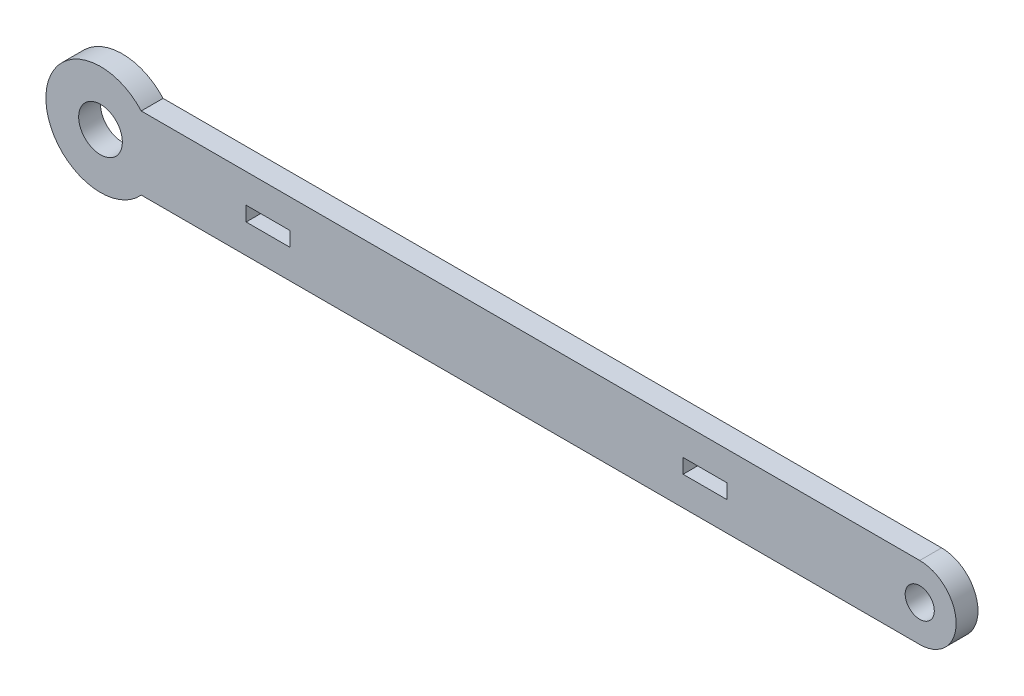
from build123d import *

# Parameters (mm, degrees)
SKETCH_1_R      = 2
SKETCH_1_R_2    = 3
SKETCH_1_W      = 6
SKETCH_1_H      = 2
EXTRUDE_1_DEPTH = 1.5


with BuildPart() as part:
    # 草图1 → 凸台-拉伸1 (new, symmetric)
    with BuildSketch(Plane.XY):
        with BuildLine():
            Line((5.590169944, 5), (112.5, 5))
            ThreePointArc((112.5, 5), (117.5, 0), (112.5, -5))
            Line((112.5, -5), (5.590169944, -5))
            ThreePointArc((5.590169944, -5), (-7.5, 0), (5.590169944, 5))
        make_face()
        with Locations((112.5, 0)):
            Circle(SKETCH_1_R, mode=Mode.SUBTRACT)
        Circle(SKETCH_1_R_2, mode=Mode.SUBTRACT)
        with Locations((23, 0)):
            Rectangle(SKETCH_1_W, SKETCH_1_H, mode=Mode.SUBTRACT)
        with Locations((83, 0)):
            Rectangle(SKETCH_1_W, SKETCH_1_H, mode=Mode.SUBTRACT)
    extrude(amount=EXTRUDE_1_DEPTH, both=True)


solid = part.part
